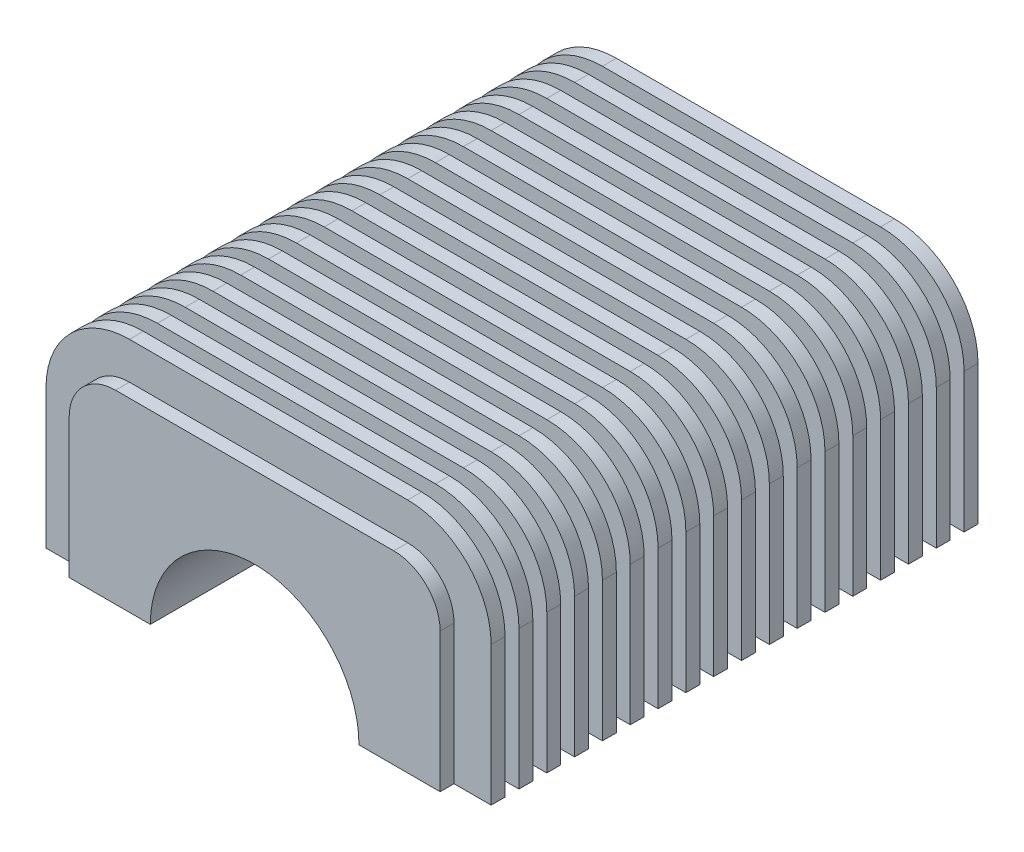
from build123d import *

# Parameters (mm, degrees)
SZKIC1_W                    = 80
SZKIC1_H                    = 40
DODANIE_WYCI_GNI_CIE1_DEPTH = 108
SZKIC2_R                    = 22.5
WYTNIJ_WYCI_GNI_CIE3_DEPTH  = 108
ZAOKR_GLENIE2_R             = 10
DODANIE_WYCI_GNI_CIE2_START = 3
DODANIE_WYCI_GNI_CIE2_DEPTH = 3
SZYK_LINIOWY4_COUNT         = 18
SZYK_LINIOWY4_PITCH         = 6


with BuildPart() as part:
    # Szkic1 → Dodanie-wyciągnięcie1 (new body)
    with BuildSketch(Plane.XY):
        with Locations((0, 20)):
            Rectangle(SZKIC1_W, SZKIC1_H)
    extrude(amount=DODANIE_WYCI_GNI_CIE1_DEPTH)

    # Szkic2 → Wytnij-wyciągnięcie3 (cut)
    with BuildSketch(Plane.XY):
        Circle(SZKIC2_R)
    extrude(amount=WYTNIJ_WYCI_GNI_CIE3_DEPTH, mode=Mode.SUBTRACT)

    # Zaokrąglenie2
    zaokr_glenie2_edges = [part.edges().sort_by_distance(p)[0] for p in [
        (-40, 40, 54),
        (40, 40, 54),
    ]]
    fillet(zaokr_glenie2_edges, radius=ZAOKR_GLENIE2_R)

    # Szkic3 → Dodanie-wyciągnięcie2 (add)
    with BuildSketch(Plane.XY.offset(DODANIE_WYCI_GNI_CIE2_START)):
        with BuildLine():
            Line((-40, 30), (-40, 0))
            Line((-40, 0), (-48, 0))
            Line((-48, 0), (-48, 30))
            ThreePointArc((-48, 30), (-42.727922061, 42.727922061), (-30, 48))
            Line((-30, 48), (30, 48))
            ThreePointArc((30, 48), (42.727922061, 42.727922061), (48, 30))
            Line((48, 30), (48, 0))
            Line((48, 0), (40, 0))
            Line((40, 0), (40, 30))
            ThreePointArc((40, 30), (37.071067812, 37.071067812), (30, 40))
            Line((30, 40), (-30, 40))
            ThreePointArc((-30, 40), (-37.071067812, 37.071067812), (-40, 30))
        make_face()
    dodanie_wyci_gni_cie2 = extrude(amount=-DODANIE_WYCI_GNI_CIE2_DEPTH)

    # Szyk liniowy4: Dodanie-wyciągnięcie2 ×18
    with Locations(*[(0, 0, i * SZYK_LINIOWY4_PITCH) for i in range(1, SZYK_LINIOWY4_COUNT)]):
        add(dodanie_wyci_gni_cie2)


solid = part.part
